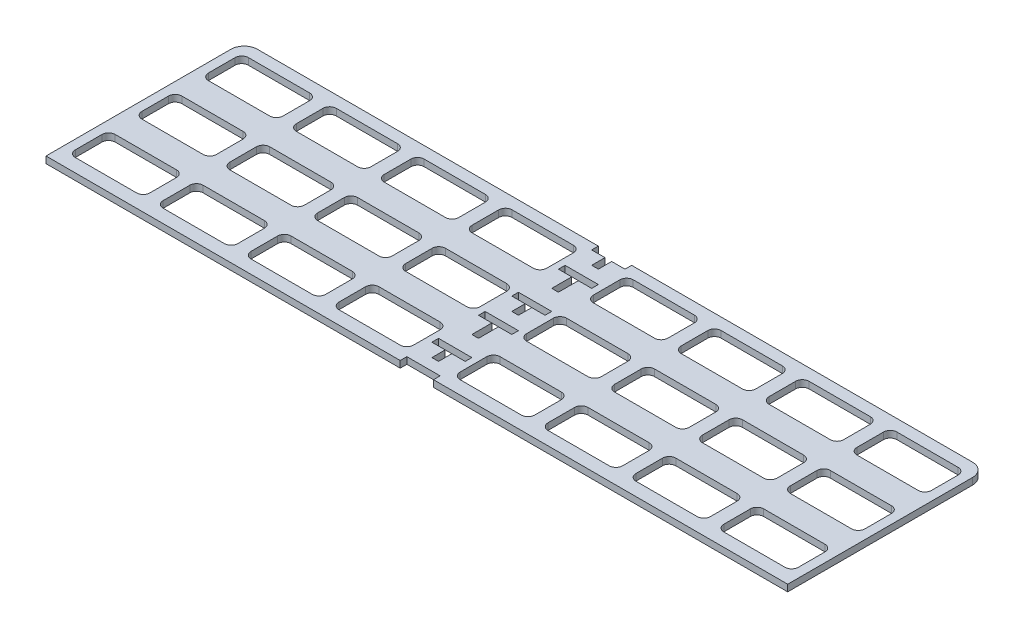
from build123d import *

# Parameters (mm, degrees)
BOSS_EXTRUDE1_DEPTH                 = 6.35
WEIGHT_SAVING_HOLES_DEPTH           = 6.35
SKETCH3_W                           = 31.75
SKETCH3_H                           = 6.35
BOOM_BRACKET_ATTACHMENT_SLOTS_DEPTH = 404.866869124


with BuildPart() as part:
    # Sketch1 → Boss-Extrude1 (new body)
    with BuildSketch(Plane(origin=(0, 0, 0), x_dir=(1, 0, 0), z_dir=(0, 1, 0))):
        with BuildLine():
            Line((0, 0), (350.52, 0))
            Line((350.52, 0), (350.52, 176.276))
            ThreePointArc((350.52, 176.276), (346.800256121, 185.256256121), (337.82, 188.976))
            Line((337.82, 188.976), (0, 188.976))
            Line((0, 188.976), (0, 169.926))
            Line((0, 169.926), (-3.175, 169.926))
            Line((-3.175, 169.926), (-3.175, 150.876))
            Line((-3.175, 150.876), (0, 150.876))
            Line((0, 150.876), (0, 131.826))
            Line((0, 131.826), (-3.175, 131.826))
            Line((-3.175, 131.826), (-3.175, 112.776))
            Line((-3.175, 112.776), (0, 112.776))
            Line((0, 112.776), (0, 93.726))
            Line((0, 93.726), (-3.175, 93.726))
            Line((-3.175, 93.726), (-3.175, 74.676))
            Line((-3.175, 74.676), (0, 74.676))
            Line((0, 74.676), (0, 55.626))
            Line((0, 55.626), (-3.175, 55.626))
            Line((-3.175, 55.626), (-3.175, 36.576))
            Line((-3.175, 36.576), (0, 36.576))
            Line((0, 36.576), (0, 17.526))
            Line((0, 17.526), (-3.175, 17.526))
            Line((-3.175, 17.526), (-3.175, 0))
            Line((-3.175, 0), (0, 0))
        make_face()
    boss_extrude1 = extrude(amount=BOSS_EXTRUDE1_DEPTH)

    # Sketch2 → Weight Saving Holes (cut)
    with BuildSketch(Plane(origin=(0, 6.35, 0), x_dir=(1, 0, 0), z_dir=(0, 1, 0))):
        with BuildLine():
            Line((270.51, 19.05), (270.51, 44.45))
            ThreePointArc((270.51, 44.45), (272.369871939, 48.940128061), (276.86, 50.8))
            Line((276.86, 50.8), (335.28, 50.8))
            ThreePointArc((335.28, 50.8), (339.770128061, 48.940128061), (341.63, 44.45))
            Line((341.63, 44.45), (341.63, 19.05))
            ThreePointArc((341.63, 19.05), (339.770128061, 14.559871939), (335.28, 12.7))
            Line((335.28, 12.7), (276.86, 12.7))
            ThreePointArc((276.86, 12.7), (272.369871939, 14.559871939), (270.51, 19.05))
        make_face()
        with BuildLine():
            Line((270.51, 82.55), (270.51, 107.95))
            ThreePointArc((270.51, 107.95), (272.369871939, 112.440128061), (276.86, 114.3))
            Line((276.86, 114.3), (335.28, 114.3))
            ThreePointArc((335.28, 114.3), (339.770128061, 112.440128061), (341.63, 107.95))
            Line((341.63, 107.95), (341.63, 82.55))
            ThreePointArc((341.63, 82.55), (339.770128061, 78.059871939), (335.28, 76.2))
            Line((335.28, 76.2), (276.86, 76.2))
            ThreePointArc((276.86, 76.2), (272.369871939, 78.059871939), (270.51, 82.55))
        make_face()
        with BuildLine():
            Line((102.87, 19.05), (102.87, 44.45))
            ThreePointArc((102.87, 44.45), (104.729871939, 48.940128061), (109.22, 50.8))
            Line((109.22, 50.8), (167.64, 50.8))
            ThreePointArc((167.64, 50.8), (172.130128061, 48.940128061), (173.99, 44.45))
            Line((173.99, 44.45), (173.99, 19.05))
            ThreePointArc((173.99, 19.05), (172.130128061, 14.559871939), (167.64, 12.7))
            Line((167.64, 12.7), (109.22, 12.7))
            ThreePointArc((109.22, 12.7), (104.729871939, 14.559871939), (102.87, 19.05))
        make_face()
        with BuildLine():
            Line((270.51, 146.05), (270.51, 171.45))
            ThreePointArc((270.51, 171.45), (272.369871939, 175.940128061), (276.86, 177.8))
            Line((276.86, 177.8), (335.28, 177.8))
            ThreePointArc((335.28, 177.8), (339.770128061, 175.940128061), (341.63, 171.45))
            Line((341.63, 171.45), (341.63, 146.05))
            ThreePointArc((341.63, 146.05), (339.770128061, 141.559871939), (335.28, 139.7))
            Line((335.28, 139.7), (276.86, 139.7))
            ThreePointArc((276.86, 139.7), (272.369871939, 141.559871939), (270.51, 146.05))
        make_face()
        with BuildLine():
            Line((25.4, 12.7), (83.82, 12.7))
            ThreePointArc((83.82, 12.7), (88.310128061, 14.559871939), (90.17, 19.05))
            Line((90.17, 19.05), (90.17, 44.45))
            ThreePointArc((90.17, 44.45), (88.310128061, 48.940128061), (83.82, 50.8))
            Line((83.82, 50.8), (25.4, 50.8))
            ThreePointArc((25.4, 50.8), (20.909871939, 48.940128061), (19.05, 44.45))
            Line((19.05, 44.45), (19.05, 19.05))
            ThreePointArc((19.05, 19.05), (20.909871939, 14.559871939), (25.4, 12.7))
        make_face()
        with BuildLine():
            Line((186.69, 19.05), (186.69, 44.45))
            ThreePointArc((186.69, 44.45), (188.549871939, 48.940128061), (193.04, 50.8))
            Line((193.04, 50.8), (251.46, 50.8))
            ThreePointArc((251.46, 50.8), (255.950128061, 48.940128061), (257.81, 44.45))
            Line((257.81, 44.45), (257.81, 19.05))
            ThreePointArc((257.81, 19.05), (255.950128061, 14.559871939), (251.46, 12.7))
            Line((251.46, 12.7), (193.04, 12.7))
            ThreePointArc((193.04, 12.7), (188.549871939, 14.559871939), (186.69, 19.05))
        make_face()
        with BuildLine():
            Line((102.87, 82.55), (102.87, 107.95))
            ThreePointArc((102.87, 107.95), (104.729871939, 112.440128061), (109.22, 114.3))
            Line((109.22, 114.3), (167.64, 114.3))
            ThreePointArc((167.64, 114.3), (172.130128061, 112.440128061), (173.99, 107.95))
            Line((173.99, 107.95), (173.99, 82.55))
            ThreePointArc((173.99, 82.55), (172.130128061, 78.059871939), (167.64, 76.2))
            Line((167.64, 76.2), (109.22, 76.2))
            ThreePointArc((109.22, 76.2), (104.729871939, 78.059871939), (102.87, 82.55))
        make_face()
        with BuildLine():
            Line((186.69, 82.55), (186.69, 107.95))
            ThreePointArc((186.69, 107.95), (188.549871939, 112.440128061), (193.04, 114.3))
            Line((193.04, 114.3), (251.46, 114.3))
            ThreePointArc((251.46, 114.3), (255.950128061, 112.440128061), (257.81, 107.95))
            Line((257.81, 107.95), (257.81, 82.55))
            ThreePointArc((257.81, 82.55), (255.950128061, 78.059871939), (251.46, 76.2))
            Line((251.46, 76.2), (193.04, 76.2))
            ThreePointArc((193.04, 76.2), (188.549871939, 78.059871939), (186.69, 82.55))
        make_face()
        with BuildLine():
            Line((102.87, 146.05), (102.87, 171.45))
            ThreePointArc((102.87, 171.45), (104.729871939, 175.940128061), (109.22, 177.8))
            Line((109.22, 177.8), (167.64, 177.8))
            ThreePointArc((167.64, 177.8), (172.130128061, 175.940128061), (173.99, 171.45))
            Line((173.99, 171.45), (173.99, 146.05))
            ThreePointArc((173.99, 146.05), (172.130128061, 141.559871939), (167.64, 139.7))
            Line((167.64, 139.7), (109.22, 139.7))
            ThreePointArc((109.22, 139.7), (104.729871939, 141.559871939), (102.87, 146.05))
        make_face()
        with BuildLine():
            Line((186.69, 146.05), (186.69, 171.45))
            ThreePointArc((186.69, 171.45), (188.549871939, 175.940128061), (193.04, 177.8))
            Line((193.04, 177.8), (251.46, 177.8))
            ThreePointArc((251.46, 177.8), (255.950128061, 175.940128061), (257.81, 171.45))
            Line((257.81, 171.45), (257.81, 146.05))
            ThreePointArc((257.81, 146.05), (255.950128061, 141.559871939), (251.46, 139.7))
            Line((251.46, 139.7), (193.04, 139.7))
            ThreePointArc((193.04, 139.7), (188.549871939, 141.559871939), (186.69, 146.05))
        make_face()
        with BuildLine():
            Line((19.05, 82.55), (19.05, 107.95))
            ThreePointArc((19.05, 107.95), (20.909871939, 112.440128061), (25.4, 114.3))
            Line((25.4, 114.3), (83.82, 114.3))
            ThreePointArc((83.82, 114.3), (88.310128061, 112.440128061), (90.17, 107.95))
            Line((90.17, 107.95), (90.17, 82.55))
            ThreePointArc((90.17, 82.55), (88.310128061, 78.059871939), (83.82, 76.2))
            Line((83.82, 76.2), (25.4, 76.2))
            ThreePointArc((25.4, 76.2), (20.909871939, 78.059871939), (19.05, 82.55))
        make_face()
        with BuildLine():
            Line((19.05, 146.05), (19.05, 171.45))
            ThreePointArc((19.05, 171.45), (20.909871939, 175.940128061), (25.4, 177.8))
            Line((25.4, 177.8), (83.82, 177.8))
            ThreePointArc((83.82, 177.8), (88.310128061, 175.940128061), (90.17, 171.45))
            Line((90.17, 171.45), (90.17, 146.05))
            ThreePointArc((90.17, 146.05), (88.310128061, 141.559871939), (83.82, 139.7))
            Line((83.82, 139.7), (25.4, 139.7))
            ThreePointArc((25.4, 139.7), (20.909871939, 141.559871939), (19.05, 146.05))
        make_face()
    weight_saving_holes = extrude(amount=-WEIGHT_SAVING_HOLES_DEPTH, mode=Mode.SUBTRACT)

    # Mirror1: Boss-Extrude1, Weight Saving Holes across plane
    add(boss_extrude1.mirror(Plane(origin=(-3.175, 6.35, -93.726), x_dir=(0, 0, 1), z_dir=(1, 0, 0))))
    add(weight_saving_holes.mirror(Plane(origin=(-3.175, 6.35, -93.726), x_dir=(0, 0, 1), z_dir=(1, 0, 0))), mode=Mode.SUBTRACT)

    # Sketch3 → Boom Bracket Attachment Slots (cut, through all)
    with BuildSketch(Plane(origin=(0, 6.35, 0), x_dir=(1, 0, 0), z_dir=(0, 1, 0))):
        with Locations((-3.175, 185.801)):
            Rectangle(SKETCH3_W, SKETCH3_H)
        with Locations((-3.175, 154.051)):
            Rectangle(SKETCH3_W, SKETCH3_H)
        with Locations((-3.175, 33.401)):
            Rectangle(SKETCH3_W, SKETCH3_H)
        with Locations((-3.175, 3.175)):
            Rectangle(SKETCH3_W, SKETCH3_H)
        with Locations((-3.175, 109.601)):
            Rectangle(SKETCH3_W, SKETCH3_H)
        with Locations((-3.175, 77.851)):
            Rectangle(SKETCH3_W, SKETCH3_H)
    extrude(amount=-BOOM_BRACKET_ATTACHMENT_SLOTS_DEPTH, mode=Mode.SUBTRACT)


solid = part.part
